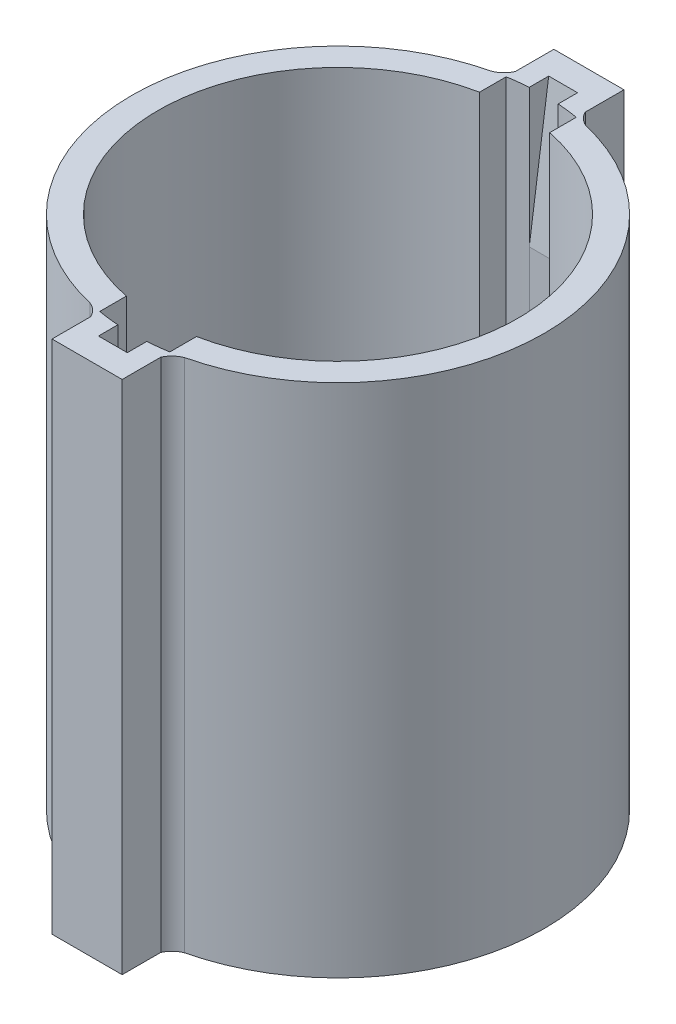
from build123d import *

# Parameters (mm, degrees)
BOSS_EXTRUDE1_DEPTH     = 50
BOSS_EXTRUDE2_DEPTH     = 2.8
CUT_EXTRUDE1_DEPTH      = 60.094773246
CUT_EXTRUDE1_DEPTH_BACK = 60.094773246


with BuildPart() as part:
    # Sketch1 → Boss-Extrude1 (new body)
    with BuildSketch(Plane(origin=(0, 0, 0), x_dir=(1, 0, 0), z_dir=(0, 1, 0))):
        with BuildLine():
            Line((3.4, 20.590136136), (3.4, 19.708881247))
            ThreePointArc((3.4, 19.708881247), (4.001170568, 19.595678965), (4.598597833, 19.464143905))
            ThreePointArc((4.598597833, 19.464143905), (3.888587722, 19.909290009), (3.4, 20.590136136))
        make_face()
        with BuildLine():
            ThreePointArc((-4.598597833, 19.464143905), (-4.001170568, 19.595678965), (-3.4, 19.708881247))
            Line((-3.4, 19.708881247), (-3.4, 20.590136136))
            ThreePointArc((-3.4, 20.590136136), (-3.888587722, 19.909290009), (-4.598597833, 19.464143905))
        make_face()
        with BuildLine():
            Line((-1.4, 19.950939827), (-1.4, 21.835))
            Line((-1.4, 21.835), (1.4, 21.835))
            Line((1.4, 21.835), (1.4, 19.950939827))
            ThreePointArc((1.4, 19.950939827), (2.403049748, 19.855108962), (3.4, 19.708881247))
            Line((3.4, 19.708881247), (3.4, 20.590136136))
            Line((3.4, 20.590136136), (3.4, 24.335))
            Line((3.4, 24.335), (-3.4, 24.335))
            Line((-3.4, 24.335), (-3.4, 20.590136136))
            Line((-3.4, 20.590136136), (-3.4, 19.708881247))
            ThreePointArc((-3.4, 19.708881247), (-2.403049748, 19.855108962), (-1.4, 19.950939827))
        make_face()
        with BuildLine():
            Line((-3.4, 17.125758377), (-3.4, 19.708881247))
            ThreePointArc((-3.4, 19.708881247), (-4.001170568, 19.595678965), (-4.598597833, 19.464143905))
            ThreePointArc((-4.598597833, 19.464143905), (-20, 0), (-4.598597833, -19.464143905))
            ThreePointArc((-4.598597833, -19.464143905), (-4.001170568, -19.595678965), (-3.4, -19.708881247))
            Line((-3.4, -19.708881247), (-3.4, -17.125758377))
            ThreePointArc((-3.4, -17.125758377), (-17.46, 0), (-3.4, 17.125758377))
        make_face()
        with BuildLine():
            ThreePointArc((4.598597833, 19.464143905), (4.001170568, 19.595678965), (3.4, 19.708881247))
            Line((3.4, 19.708881247), (3.4, 17.125758377))
            ThreePointArc((3.4, 17.125758377), (13.494732306, 11.078980097), (17.46, 0))
            ThreePointArc((17.46, 0), (13.494732306, -11.078980097), (3.4, -17.125758377))
            Line((3.4, -17.125758377), (3.4, -19.708881247))
            ThreePointArc((3.4, -19.708881247), (4.001170568, -19.595678965), (4.598597833, -19.464143905))
            ThreePointArc((4.598597833, -19.464143905), (15.683940141, -12.410238582), (20, 0))
            ThreePointArc((20, 0), (15.683940141, 12.410238582), (4.598597833, 19.464143905))
        make_face()
        with BuildLine():
            ThreePointArc((4.598597833, -19.464143905), (4.001170568, -19.595678965), (3.4, -19.708881247))
            Line((3.4, -19.708881247), (3.4, -20.590136136))
            ThreePointArc((3.4, -20.590136136), (3.888587722, -19.909290009), (4.598597833, -19.464143905))
        make_face()
        with BuildLine():
            ThreePointArc((-3.4, -19.708881247), (-4.001170568, -19.595678965), (-4.598597833, -19.464143905))
            ThreePointArc((-4.598597833, -19.464143905), (-3.888587722, -19.909290009), (-3.4, -20.590136136))
            Line((-3.4, -20.590136136), (-3.4, -19.708881247))
        make_face()
        with BuildLine():
            Line((-1.4, -21.835), (-1.4, -19.950939827))
            ThreePointArc((-1.4, -19.950939827), (-2.403049748, -19.855108962), (-3.4, -19.708881247))
            Line((-3.4, -19.708881247), (-3.4, -20.590136136))
            Line((-3.4, -20.590136136), (-3.4, -24.335))
            Line((-3.4, -24.335), (3.4, -24.335))
            Line((3.4, -24.335), (3.4, -20.590136136))
            Line((3.4, -20.590136136), (3.4, -19.708881247))
            ThreePointArc((3.4, -19.708881247), (2.403049748, -19.855108962), (1.4, -19.950939827))
            Line((1.4, -19.950939827), (1.4, -21.835))
            Line((1.4, -21.835), (-1.4, -21.835))
        make_face()
    extrude(amount=BOSS_EXTRUDE1_DEPTH)

    # Sketch2 → Boss-Extrude2 (add)
    with BuildSketch(Plane(origin=(-1.4, 0, 0), x_dir=(0, 0, -1), z_dir=(1, 0, 0))):
        Polygon((21.835, 0), (21.835, 50), (19.950939827, 36.594215293), (19.950939827, 0), align=None)
        Polygon((-21.835, 50), (-21.835, 0), (-14.807958265, 0), align=None)
    extrude(amount=BOSS_EXTRUDE2_DEPTH)

    # Sketch3 → Cut-Extrude1 (cut, two sides: drawn at the far end of the back side and taken through both)
    with BuildSketch(Plane.XZ.offset(-CUT_EXTRUDE1_DEPTH_BACK)):
        with BuildLine():
            ThreePointArc((1.4, 19.950939827), (0, 20), (-1.4, 19.950939827))
            Line((-1.4, 19.950939827), (-1.4, 14.807958265))
            Line((-1.4, 14.807958265), (1.4, 14.807958265))
            Line((1.4, 14.807958265), (1.4, 19.950939827))
        make_face()
    extrude(amount=CUT_EXTRUDE1_DEPTH + CUT_EXTRUDE1_DEPTH_BACK, mode=Mode.SUBTRACT)


solid = part.part
